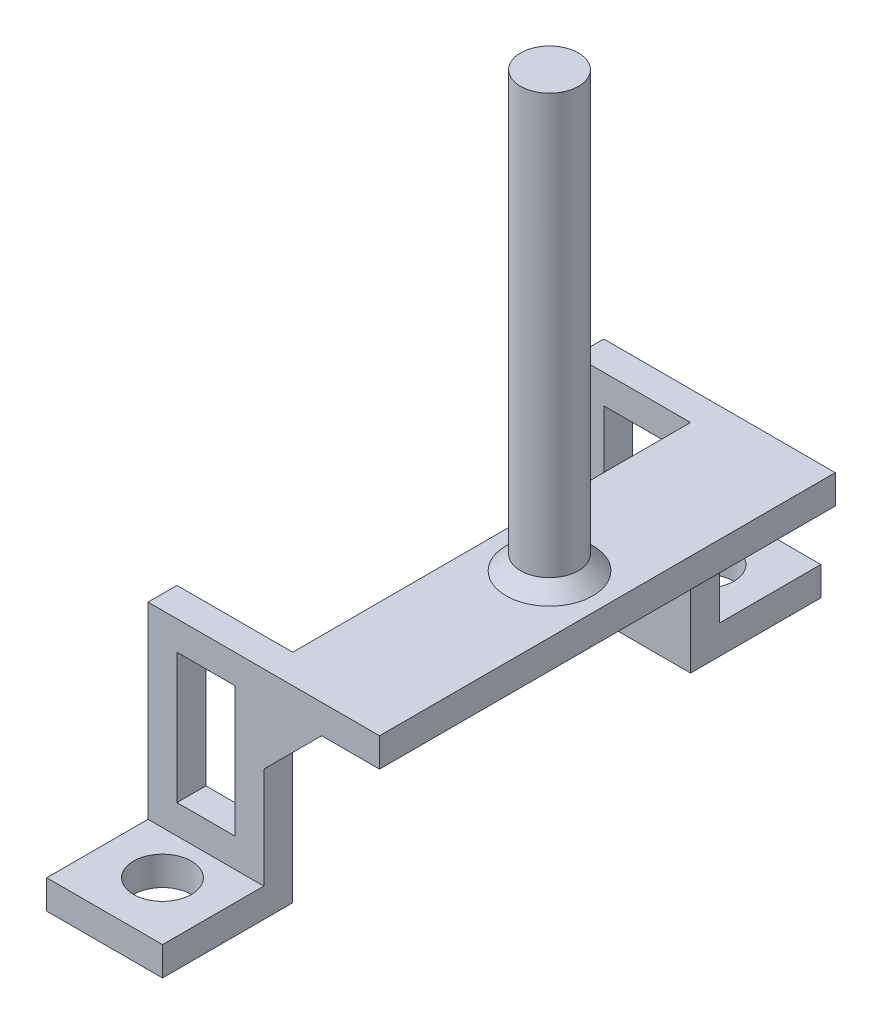
from build123d import *

# Parameters (mm, degrees)
SKETCH1_W             = 8
SKETCH1_H             = 8
SKETCH1_R             = 2
BOSS_EXTRUDE1_DEPTH   = 2
BOSS_EXTRUDE1_2_DEPTH = 2
SKETCH2_W             = 8
SKETCH2_H             = 2
BOSS_EXTRUDE2_DEPTH   = 15
BOSS_EXTRUDE3_REACH   = 43.512
SKETCH3_W             = 8
SKETCH3_H             = 2
CHAMFER1_SIZE         = 4
SKETCH4_W             = 4
SKETCH4_H             = 9
CUT_EXTRUDE1_DEPTH    = 44.026154836
SKETCH5_R             = 2
BOSS_EXTRUDE4_DEPTH   = 30
CHAMFER2_SIZE         = 1


with BuildPart() as part:
    # Sketch1 → Boss-Extrude1 (new body)
    with BuildSketch(Plane(origin=(0, 0, 0), x_dir=(1, 0, 0), z_dir=(0, 1, 0))):
        Rectangle(SKETCH1_W, SKETCH1_H)
        with Locations(Location((0, 0, 0), (0, 0, 270))):
            Circle(SKETCH1_R, mode=Mode.SUBTRACT)
    extrude(amount=BOSS_EXTRUDE1_DEPTH)



with BuildPart() as body_2:
    # Sketch1 → Boss-Extrude1 2 (new body)
    with BuildSketch(Plane(origin=(0, 0, 0), x_dir=(1, 0, 0), z_dir=(0, 1, 0))):
        with Locations((0, 37.5)):
            Rectangle(SKETCH1_W, SKETCH1_H)
        with Locations(Location((0, 37.5, 0), (0, 0, 270))):
            Circle(SKETCH1_R, mode=Mode.SUBTRACT)
    extrude(amount=BOSS_EXTRUDE1_2_DEPTH)


with BuildPart() as part_1:
    add(part.part)

    add(body_2.part)  # Boss-Extrude2 merges body 2
    # Sketch2 → Boss-Extrude2 (add)
    with BuildSketch(Plane.XZ):
        with Locations((0, -33.5)):
            Rectangle(SKETCH2_W, SKETCH2_H)
        with Locations((0, -4)):
            Rectangle(SKETCH2_W, SKETCH2_H)
    extrude(amount=-BOSS_EXTRUDE2_DEPTH)

    # Boss-Extrude3: up to this face of the body (flat: up to its plane)
    boss_extrude3_end = Plane(part_1.part.faces().sort_by_distance((0, 8.5, -3))[0])
    # Sketch3 → Boss-Extrude3 (add, up to the picked face)
    with BuildSketch(Plane.XY.offset(-34.5), mode=Mode.PRIVATE) as boss_extrude3_sk1:
        with Locations((8, 14)):
            Rectangle(SKETCH3_W, SKETCH3_H)
    boss_extrude3_tool1 = split(extrude(boss_extrude3_sk1.sketch, amount=BOSS_EXTRUDE3_REACH, mode=Mode.PRIVATE), bisect_by=boss_extrude3_end, keep=Keep.BOTH, mode=Mode.PRIVATE)
    add(boss_extrude3_tool1.solids().sort_by(Axis((8, 14, -34.5), (0, 0, 1)))[0])

    # Chamfer1
    chamfer1_edges = [part_1.edges().sort_by_distance(p)[0] for p in [
        (4, 13, -4),
        (4, 13, -33.5),
    ]]
    chamfer(chamfer1_edges, length=CHAMFER1_SIZE)

    # Sketch4 → Cut-Extrude1 (cut, through all)
    with BuildSketch(Plane.XY.offset(-3)):
        with Locations((0, 8.5)):
            Rectangle(SKETCH4_W, SKETCH4_H)
    extrude(amount=-CUT_EXTRUDE1_DEPTH, mode=Mode.SUBTRACT)

    # Sketch5 → Boss-Extrude4 (add)
    with BuildSketch(Plane(origin=(0, 15, 0), x_dir=(1, 0, 0), z_dir=(0, 1, 0))):
        with Locations(Location((8, 18.75, 0), (0, 0, 90))):
            Circle(SKETCH5_R)
    extrude(amount=BOSS_EXTRUDE4_DEPTH)

    # Chamfer2
    chamfer2_edges = [part_1.edges().sort_by_distance(p)[0] for p in [
        (8, 15, -16.75),
    ]]
    chamfer(chamfer2_edges, length=CHAMFER2_SIZE)


solid = part_1.part
